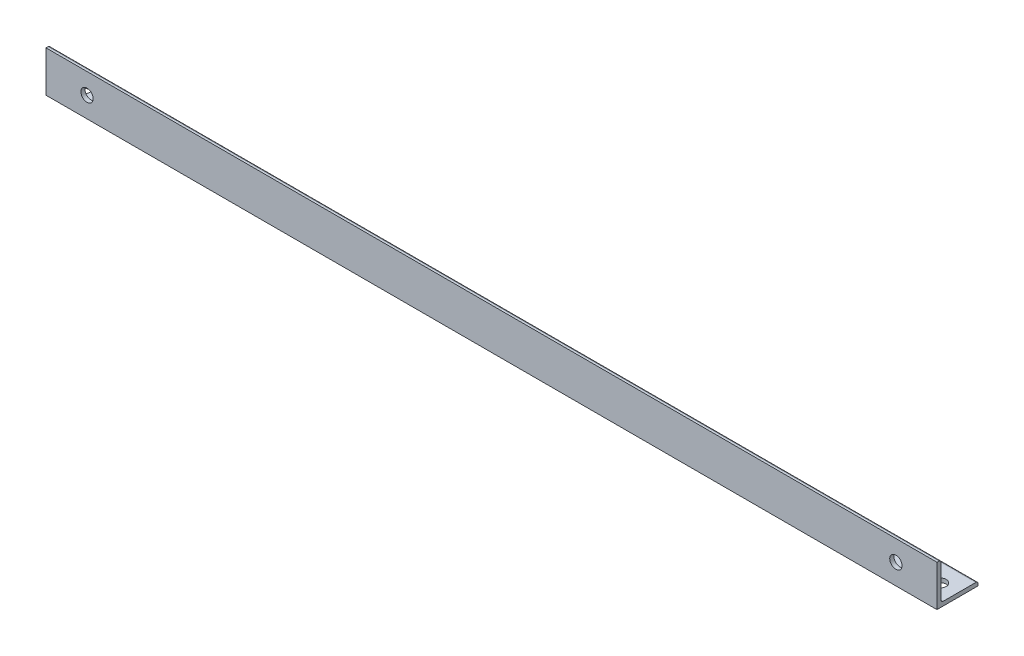
from build123d import *

# Parameters (mm, degrees)
EXTRUDE_1_DEPTH     = 434
SKETCH_2_R          = 3
CUT_EXTRUDE_1_DEPTH = 435.920682424
SKETCH_3_R          = 3
CUT_EXTRUDE_2_DEPTH = 435.833301393
SKETCH_5_R          = 3
CUT_EXTRUDE_4_DEPTH = 2


with BuildPart() as part:
    # Эскиз1 → Бобышка-Вытянуть1 (new body)
    with BuildSketch(Plane(origin=(0, 0, 0), x_dir=(0, 0, -1), z_dir=(1, 0, 0))):
        with BuildLine():
            Line((0, 0), (0, 20))
            Line((0, 20), (1, 20))
            ThreePointArc((1, 20), (1.707106781, 19.707106781), (2, 19))
            Line((2, 19), (2, 3))
            ThreePointArc((2, 3), (2.292893219, 2.292893219), (3, 2))
            Line((3, 2), (19, 2))
            ThreePointArc((19, 2), (19.707106781, 1.707106781), (20, 1))
            Line((20, 1), (20, 0))
            Line((20, 0), (0, 0))
        make_face()
    extrude(amount=EXTRUDE_1_DEPTH)

    # Эскиз2 → Вырез-Вытянуть1 (cut, through all)
    with BuildSketch(Plane.XZ):
        with Locations(Location((425.5, -10, 0), (0, 0, 270))):
            Circle(SKETCH_2_R)
        with Locations(Location((8.5, -10, 0), (0, 0, 270))):
            Circle(SKETCH_2_R)
    extrude(amount=-CUT_EXTRUDE_1_DEPTH, mode=Mode.SUBTRACT)

    # Эскиз3 → Вырез-Вытянуть2 (cut, through all)
    with BuildSketch(Plane(origin=(0, 0, -2), x_dir=(-1, 0, 0), z_dir=(0, 0, -1))):
        with Locations(Location((-414, 10, 0), (0, 0, 90))):
            Circle(SKETCH_3_R)
        with Locations(Location((-20, 10, 0), (0, 0, 90))):
            Circle(SKETCH_3_R)
    extrude(amount=-CUT_EXTRUDE_2_DEPTH, mode=Mode.SUBTRACT)

    # Эскиз5 → Вырез-Вытянуть4 (cut)
    with BuildSketch(Plane(origin=(0, 2, 0), x_dir=(1, 0, 0), z_dir=(0, 1, 0))):
        with Locations(Location((184.5, 10, 0), (0, 0, 270))):
            Circle(SKETCH_5_R)
    extrude(amount=-CUT_EXTRUDE_4_DEPTH, mode=Mode.SUBTRACT)


solid = part.part
